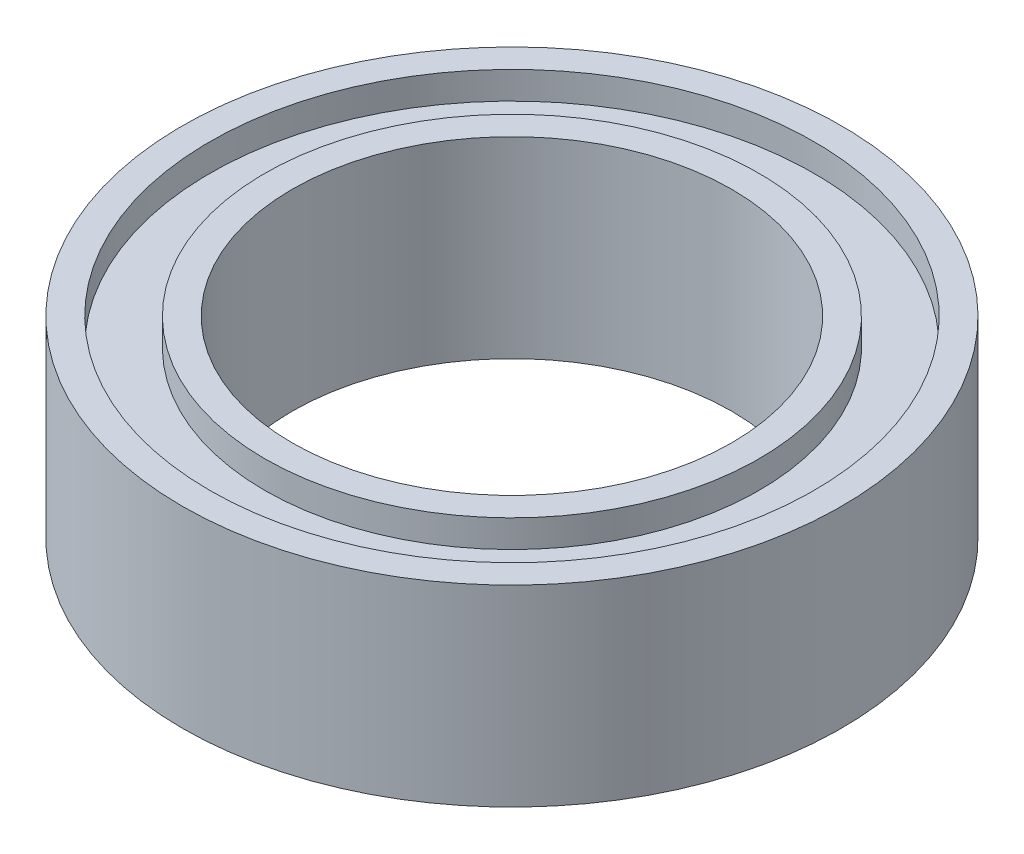
from build123d import *

# Parameters (mm, degrees)
SKETCH_1_R          = 4.5
SKETCH_1_R_2        = 4
EXTRUDE_1_DEPTH     = 3.5
SKETCH_1_3_R        = 5.5
SKETCH_1_3_R_2      = 4.5
EXTRUDE_2_DEPTH     = 3
SKETCH_1_4_R        = 6
SKETCH_1_4_R_2      = 5.5
EXTRUDE_3_DEPTH     = 3.5
SKETCH_1_5_R        = 5.5
SKETCH_1_5_R_2      = 4.5
CUT_EXTRUDE_1_DEPTH = 0.5


with BuildPart() as part:
    # 草图1 → 凸台-拉伸1 (new body)
    with BuildSketch(Plane(origin=(0, 0, 0), x_dir=(1, 0, 0), z_dir=(0, 1, 0))):
        Circle(SKETCH_1_R)
        Circle(SKETCH_1_R_2, mode=Mode.SUBTRACT)
    extrude(amount=EXTRUDE_1_DEPTH)

    # 草图1<3> → 凸台-拉伸2 (add)
    with BuildSketch(Plane(origin=(0, 0, 0), x_dir=(1, 0, 0), z_dir=(0, 1, 0))):
        Circle(SKETCH_1_3_R)
        Circle(SKETCH_1_3_R_2, mode=Mode.SUBTRACT)
    extrude(amount=EXTRUDE_2_DEPTH)

    # 草图1<4> → 凸台-拉伸3 (add)
    with BuildSketch(Plane(origin=(0, 0, 0), x_dir=(1, 0, 0), z_dir=(0, 1, 0))):
        Circle(SKETCH_1_4_R)
        Circle(SKETCH_1_4_R_2, mode=Mode.SUBTRACT)
    extrude(amount=EXTRUDE_3_DEPTH)

    # 草图1<5> → 切除-拉伸1 (cut)
    with BuildSketch(Plane(origin=(0, 0, 0), x_dir=(1, 0, 0), z_dir=(0, 1, 0))):
        Circle(SKETCH_1_5_R)
        Circle(SKETCH_1_5_R_2, mode=Mode.SUBTRACT)
    extrude(amount=CUT_EXTRUDE_1_DEPTH, mode=Mode.SUBTRACT)


solid = part.part
